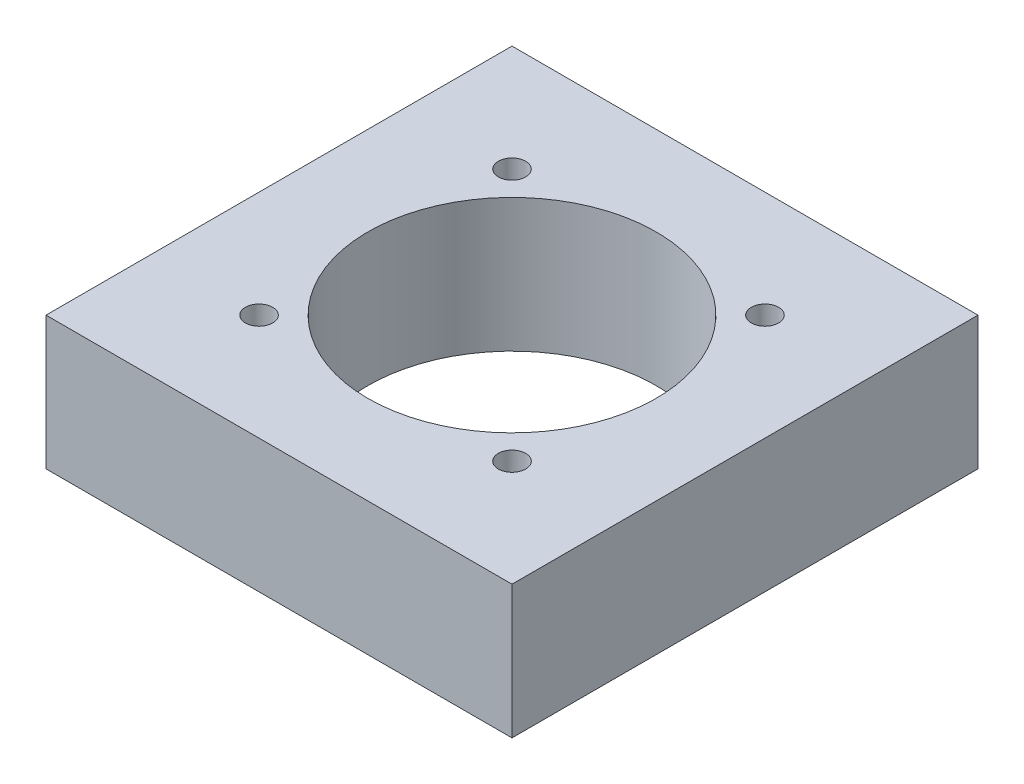
from build123d import *

# Parameters (mm, degrees)
SKETCH2_W           = 70
SKETCH2_H           = 70
BOSS_EXTRUDE1_DEPTH = 20
SKETCH3_R           = 2.05
CUT_EXTRUDE1_DEPTH  = 54.38539126
SKETCH4_R           = 21.658851084
CUT_EXTRUDE2_DEPTH  = 54.38539126


with BuildPart() as part:
    # Sketch2 → Boss-Extrude1 (new body)
    with BuildSketch(Plane(origin=(0, 0, 0), x_dir=(1, 0, 0), z_dir=(0, 1, 0))):
        Rectangle(SKETCH2_W, SKETCH2_H)
    extrude(amount=-BOSS_EXTRUDE1_DEPTH)

    # Sketch1 → Cut-Revolve1 (revolve, cut)
    with BuildSketch(Plane.XY, mode=Mode.PRIVATE) as cut_revolve1_sk:
        with BuildLine():
            Line((0, -17.2), (0, 0))
            Line((0, 0), (21.241684944, 0))
            Line((21.241684944, 0), (21.158851084, -0.511526958))
            add(Edge.make_bspline(
                [(0, -17.2), (0.530678283, -17.2), (1.61157482, -17.183508716), (3.615531125, -17.08588663), (5.944127269, -16.844919371), (8.44843367, -16.370131279), (11.442656399, -15.492934033), (14.579654851, -13.93724298), (17.382164488, -11.402739011), (19.199009229, -8.500896664), (20.23569058, -5.583194157), (20.706490619, -3.313387562), (20.981886079, -1.635929169), (21.096876841, -0.894238762), (21.158851084, -0.511526958)],
                knots=[0, 0, 0, 0, 0.03125, 0.0625, 0.125, 0.1875, 0.25, 0.375, 0.5, 0.625, 0.75, 0.875, 0.9375, 1, 1, 1, 1], degree=3))
        make_face()
    revolve(cut_revolve1_sk.sketch.rotate(Axis((0, -17.2, 0), (0, 1, 0)), 90), axis=Axis((0, -17.2, 0), (0, 1, 0)), mode=Mode.SUBTRACT)

    # Sketch3 → Cut-Extrude1 (cut, through all)
    with BuildSketch(Plane(origin=(0, 0, 0), x_dir=(1, 0, 0), z_dir=(0, 1, 0))):
        with Locations(Location((-19, 19, 0), (0, 0, 270))):
            Circle(SKETCH3_R)
        with Locations(Location((19, -19, 0), (0, 0, 90))):
            Circle(SKETCH3_R)
        with Locations(Location((-19, -19, 0), (0, 0, 90))):
            Circle(SKETCH3_R)
        with Locations(Location((19, 19, 0), (0, 0, 270))):
            Circle(SKETCH3_R)
    extrude(amount=-CUT_EXTRUDE1_DEPTH, mode=Mode.SUBTRACT)

    # Sketch4 → Cut-Extrude2 (cut, through all)
    with BuildSketch(Plane(origin=(0, 0, 0), x_dir=(1, 0, 0), z_dir=(0, 1, 0))):
        with Locations(Location((0, 0, 0), (0, 0, 270))):
            Circle(SKETCH4_R)
    extrude(amount=-CUT_EXTRUDE2_DEPTH, mode=Mode.SUBTRACT)


solid = part.part
